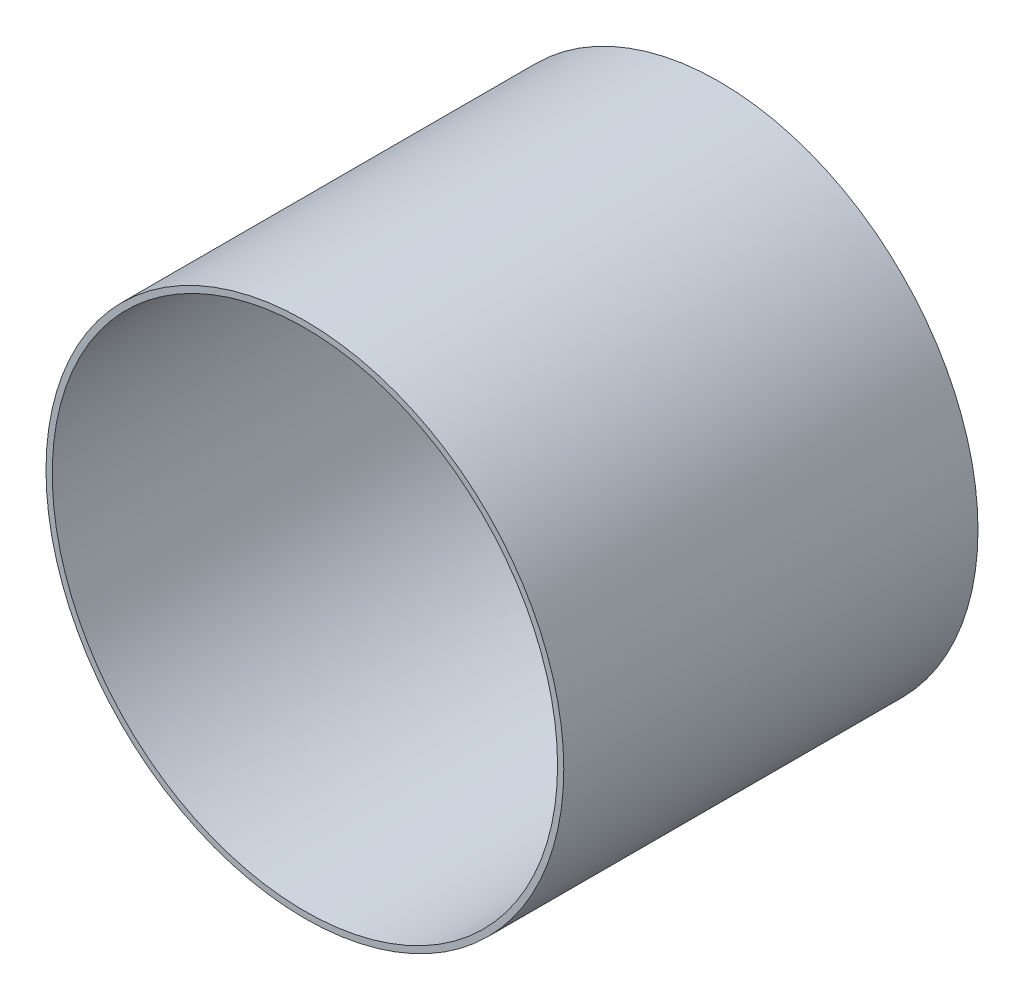
from build123d import *

# Parameters (mm, degrees)
CROQUIS1_R              = 25
CROQUIS1_R_2            = 24.4
SALIENTE_EXTRUIR1_DEPTH = 40


with BuildPart() as part:
    # Croquis1 → Saliente-Extruir1 (new body)
    with BuildSketch(Plane.XY):
        with Locations((-50.662399686, 7.111464469)):
            Circle(CROQUIS1_R)
        with Locations((-50.662399686, 7.111464469)):
            Circle(CROQUIS1_R_2, mode=Mode.SUBTRACT)
    extrude(amount=SALIENTE_EXTRUIR1_DEPTH)


solid = part.part
